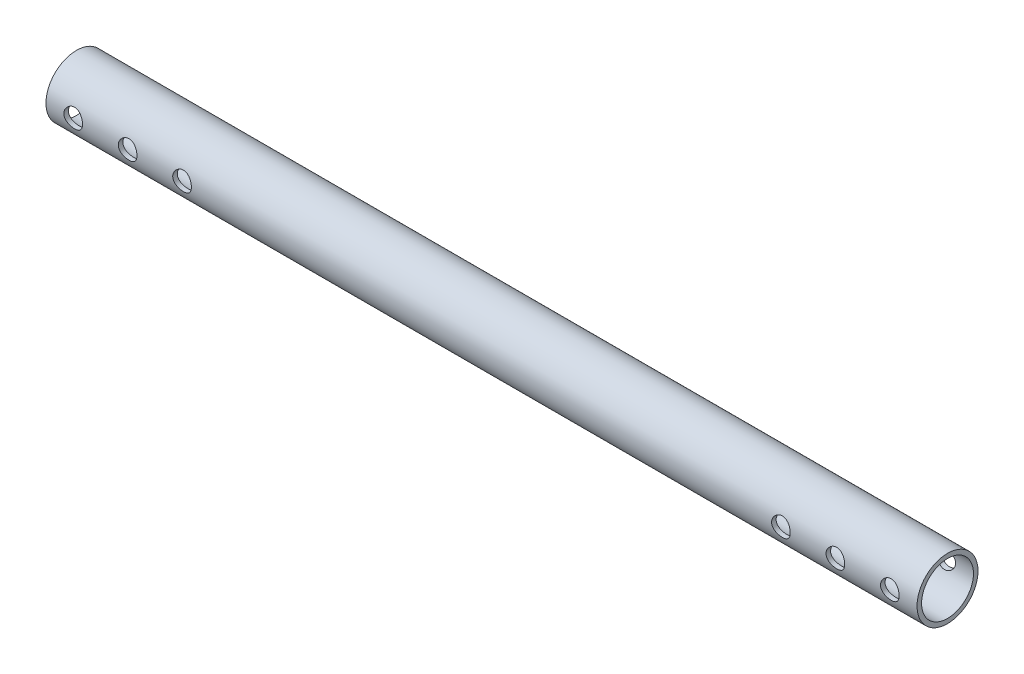
from build123d import *

# Parameters (mm, degrees)
SKETCH1_R               = 10.668
SKETCH1_R_2             = 9.0805
BOSS_EXTRUDE1_DEPTH     = 304.8
CUT_EXTRUDE1_DEPTH      = 306.686133882
CUT_EXTRUDE1_DEPTH_BACK = 306.686133882
SKETCH2_R               = 3.2639


with BuildPart() as part:
    # Sketch1 → Boss-Extrude1 (new body)
    with BuildSketch(Plane(origin=(0, 0, 0), x_dir=(0, 0, -1), z_dir=(1, 0, 0))):
        with Locations(Location((0, 0, 0), (0, 0, 180))):
            Circle(SKETCH1_R)
        with Locations(Location((0, 0, 0), (0, 0, 180))):
            Circle(SKETCH1_R_2, mode=Mode.SUBTRACT)
    extrude(amount=BOSS_EXTRUDE1_DEPTH)

    # Sketch2 → Cut-Extrude1 (cut, two sides: drawn at the far end of the back side and taken through both)
    with BuildSketch(Plane.XY.offset(10).offset(-CUT_EXTRUDE1_DEPTH_BACK)):
        with Locations((9.525, 0)):
            Circle(SKETCH2_R)
        with Locations((28.575, 0)):
            Circle(SKETCH2_R)
        with Locations((47.625, 0)):
            Circle(SKETCH2_R)
        with Locations((295.275, 0)):
            Circle(SKETCH2_R)
        with Locations((276.225, 0)):
            Circle(SKETCH2_R)
        with Locations((257.175, 0)):
            Circle(SKETCH2_R)
    extrude(amount=CUT_EXTRUDE1_DEPTH + CUT_EXTRUDE1_DEPTH_BACK, mode=Mode.SUBTRACT)


solid = part.part
